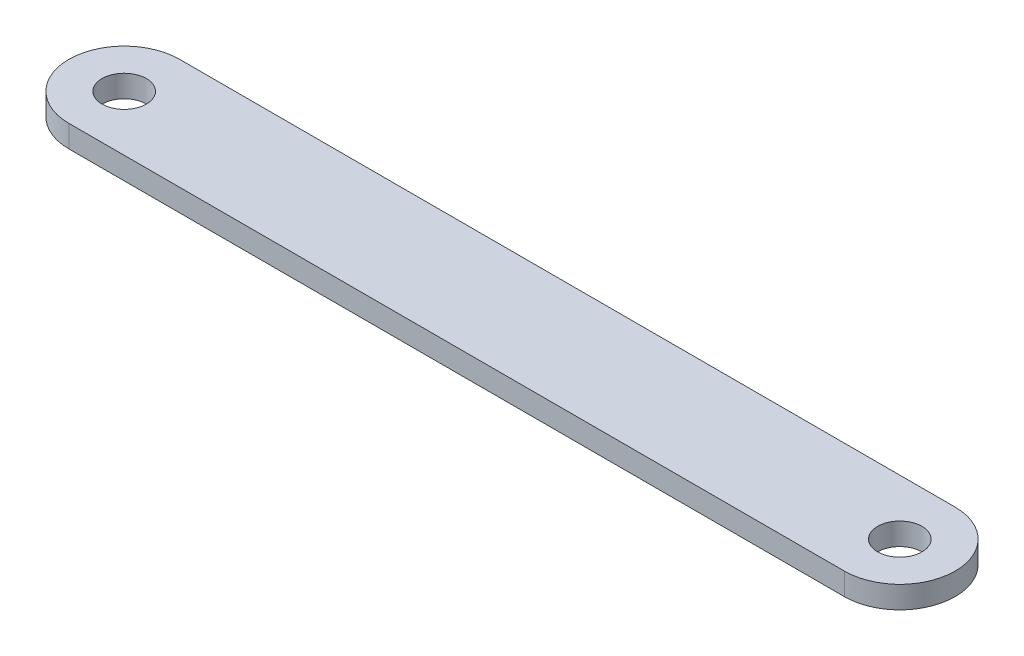
from build123d import *

# Parameters (mm, degrees)
SKETCH1_R           = 2.54
BOSS_EXTRUDE2_DEPTH = 2.54


with BuildPart() as part:
    # Sketch1 → Boss-Extrude2 (new body)
    with BuildSketch(Plane(origin=(0, 0, 0), x_dir=(1, 0, 0), z_dir=(0, 1, 0))):
        with BuildLine():
            Line((0, 0), (88.9, 0))
            ThreePointArc((88.9, 0), (95.25, 6.35), (88.9, 12.7))
            Line((88.9, 12.7), (0, 12.7))
            ThreePointArc((0, 12.7), (-6.35, 6.35), (0, 0))
        make_face()
        with Locations(Location((0, 6.35, 0), (0, 0, 270))):
            Circle(SKETCH1_R, mode=Mode.SUBTRACT)
        with Locations(Location((88.9, 6.35, 0), (0, 0, 270))):
            Circle(SKETCH1_R, mode=Mode.SUBTRACT)
    extrude(amount=BOSS_EXTRUDE2_DEPTH)


solid = part.part
